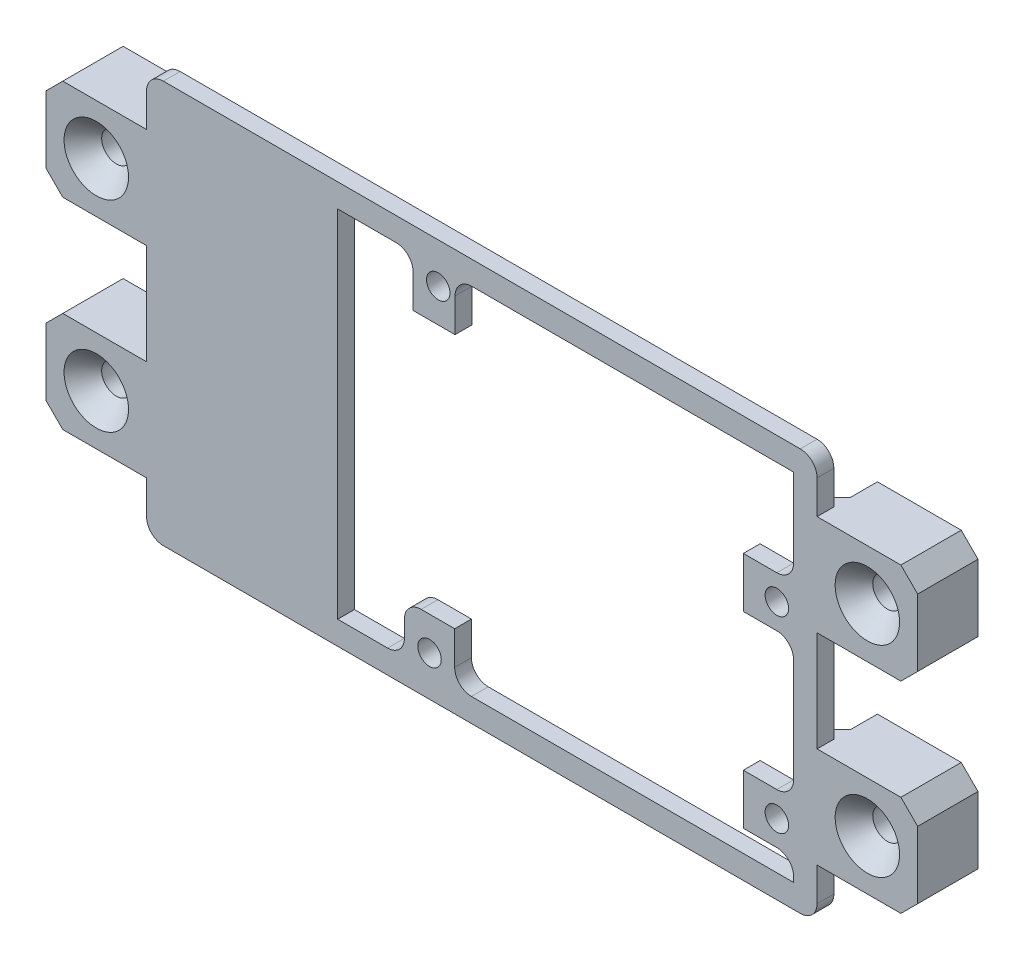
from build123d import *

# Parameters (mm, degrees)
SKETCH1_W               = 100
SKETCH1_H               = 60
SKETCH1_R               = 1.75
BOSS_EXTRUDE1_DEPTH     = 2.5
SKETCH2_W               = 15
SKETCH2_H               = 15
BOSS_EXTRUDE2_DEPTH     = 9
MIRROR2_COPY_1_SKETCH_W = 15
MIRROR2_COPY_1_SKETCH_H = 15
MIRROR2_COPY_1_DEPTH    = 9
FILLET1_R               = 2.5
FILLET2_R               = 2.5
CHAMFER1_SIZE           = 2.5


with BuildPart() as part:
    # Sketch1 → Boss-Extrude1 (new body)
    with BuildSketch(Plane.XY):
        with Locations((-12.5, 0)):
            Rectangle(SKETCH1_W, SKETCH1_H)
        Polygon((-34, -26.5), (-34, 26.5), (-22.75, 26.5), (-22.75, 19), (-16.5, 19), (-16.5, 26.5), (34, 26.5), (34, 12.25), (26.5, 12.25), (26.5, 4.75), (34, 4.75), (34, -15.75), (26.5, -15.75), (26.5, -23.25), (34, -23.25), (34, -26.5), (-16.55, -26.5), (-16.55, -19), (-24.05, -19), (-24.05, -26.5), align=None, mode=Mode.SUBTRACT)
        with Locations((-19, 24)):
            Circle(SKETCH1_R, mode=Mode.SUBTRACT)
        with Locations((-20.3, -24)):
            Circle(SKETCH1_R, mode=Mode.SUBTRACT)
        with Locations((31.5, 8.5)):
            Circle(SKETCH1_R, mode=Mode.SUBTRACT)
        with Locations((31.5, -19.5)):
            Circle(SKETCH1_R, mode=Mode.SUBTRACT)
    extrude(amount=BOSS_EXTRUDE1_DEPTH)

    # Sketch2 → Boss-Extrude2 (add)
    with BuildSketch(Plane.XY.offset(2.5)):
        with Locations((-70, 15)):
            Rectangle(SKETCH2_W, SKETCH2_H)
    boss_extrude2 = extrude(amount=-BOSS_EXTRUDE2_DEPTH)

    # Sketch3 → Cut-Revolve1 (revolve, cut)
    with BuildSketch(Plane.ZY.offset(70), mode=Mode.PRIVATE) as cut_revolve1_sk:
        Polygon((2.5, 15), (-6.5, 15), (-6.5, 12.8), (-0.5, 12.8), (2.5, 10.192139787), align=None)
    cut_revolve1 = revolve(cut_revolve1_sk.sketch.rotate(Axis((-70, 15, 2.5), (0, 0, -1)), 270), axis=Axis((-70, 15, 2.5), (0, 0, -1)), mode=Mode.SUBTRACT)

    # Mirror1: Boss-Extrude2, Cut-Revolve1 across plane
    add(boss_extrude2.mirror(Plane.ZX))
    add(cut_revolve1.mirror(Plane.ZX), mode=Mode.SUBTRACT)

    # Mirror2: Boss-Extrude2, Cut-Revolve1 across plane
    add(boss_extrude2.mirror(Plane.ZY.offset(12.5)))
    add(cut_revolve1.mirror(Plane.ZY.offset(12.5)), mode=Mode.SUBTRACT)

    # Mirror2 copy 1 sketch → Mirror2 copy 1 (add)
    with BuildSketch(Plane(origin=(-25, 0, 2.5), x_dir=(-1, 0, 0), z_dir=(0, 0, 1))):
        with Locations((-70, 15)):
            Rectangle(MIRROR2_COPY_1_SKETCH_W, MIRROR2_COPY_1_SKETCH_H)
    extrude(amount=-MIRROR2_COPY_1_DEPTH)

    # Mirror2 copy 2 sketch → Mirror2 copy 2 (revolve, cut)
    with BuildSketch(Plane(origin=(45, 0, 0), x_dir=(0, 0, 1), z_dir=(1, 0, 0))):
        Polygon((2.5, 15), (-6.5, 15), (-6.5, 12.8), (-0.5, 12.8), (2.5, 10.192139787), align=None)
    revolve(axis=Axis((45, -15, 2.5), (0, 0, -1)), mode=Mode.SUBTRACT)

    # Fillet1
    fillet1_edges = [part.edges().sort_by_distance(p)[0] for p in [
        (-24.05, -26.5, 1.25),
        (-24.05, -19, 1.25),
        (-16.55, -26.5, 1.25),
        (34, -23.25, 1.25),
        (34, -15.75, 1.25),
        (34, 4.75, 1.25),
        (34, 12.25, 1.25),
        (-16.5, 26.5, 1.25),
        (-22.75, 26.5, 1.25),
    ]]
    fillet(fillet1_edges, radius=FILLET1_R)

    # Fillet2
    fillet2_edges = [part.edges().sort_by_distance(p)[0] for p in [
        (37.5, -30, 1.25),
        (-62.5, -30, 1.25),
        (-62.5, 30, 1.25),
        (37.5, 30, 1.25),
    ]]
    fillet(fillet2_edges, radius=FILLET2_R)

    # Chamfer1
    chamfer1_edges = [part.edges().sort_by_distance(p)[0] for p in [
        (-62.5, -15, 0),
        (-77.5, -22.5, -2),
        (-77.5, -7.5, -2),
        (37.5, -15, 0),
        (52.5, -7.5, -2),
        (52.5, -22.5, -2),
        (37.5, 15, 0),
        (52.5, 22.5, -2),
        (52.5, 7.5, -2),
        (-62.5, 15, 0),
        (-77.5, 7.5, -2),
        (-77.5, 22.5, -2),
    ]]
    chamfer(chamfer1_edges, length=CHAMFER1_SIZE)


solid = part.part
